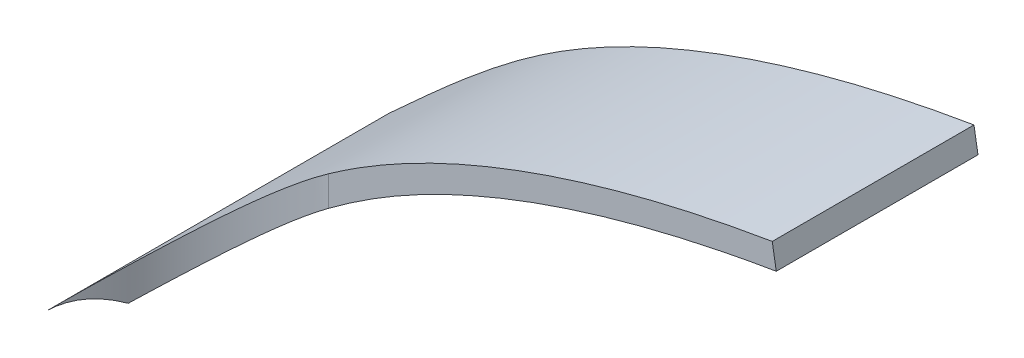
from build123d import *

# Parameters (mm, degrees)
EXTRUDE_1_DEPTH     = 10
CUT_EXTRUDE_1_DEPTH = 31


with BuildPart() as part:
    # 草图1 → 凸台-拉伸1 (new body)
    with BuildSketch(Plane.XY):
        with BuildLine():
            Line((0.099286908, 16.408271929), (0, 17))
            add(Edge.make_bspline(
                [(-14.5, 10), (-13.275700684, 11.118325177), (-10.667201811, 13.52025873), (-5.620487725, 15.809154008), (-1.923873666, 16.677190458), (0, 17)],
                knots=[0, 0, 0, 0, 0.304837744, 0.643087388, 1, 1, 1, 1], degree=3))
            Line((-14.5, 10), (-14.095342354, 9.5569964))
            add(Edge.make_bspline(
                [(-14.095342354, 9.5569964), (-13.101804871, 10.464534261), (-11.5913204, 11.856193918), (-9.408207232, 13.308108948), (-7.031706102, 14.512216909), (-3.856829789, 15.620046614), (-1.224798532, 16.18610172), (0.099286908, 16.408271929)],
                knots=[0, 0, 0, 0, 0.25, 0.375, 0.5, 0.75, 1, 1, 1, 1], degree=3))
        make_face()
    extrude(amount=EXTRUDE_1_DEPTH)

    # 草图2 → 切除-拉伸1 (cut)
    with BuildSketch(Plane(origin=(0, 0, 0), x_dir=(1, 0, 0), z_dir=(0, 1, 0))):
        with BuildLine():
            Line((2.542403036, -5), (-11, -5))
            ThreePointArc((-11, -5), (-13.474873734, -6.025126266), (-14.5, -8.5))
            Line((-14.5, -8.5), (-14.5, -10))
            Line((-14.5, -10), (-14.5, -12.270940409))
            Line((-14.5, -12.270940409), (2.542403036, -12.270940409))
            Line((2.542403036, -12.270940409), (2.542403036, -5))
        make_face()
    extrude(amount=CUT_EXTRUDE_1_DEPTH, mode=Mode.SUBTRACT)


solid = part.part
